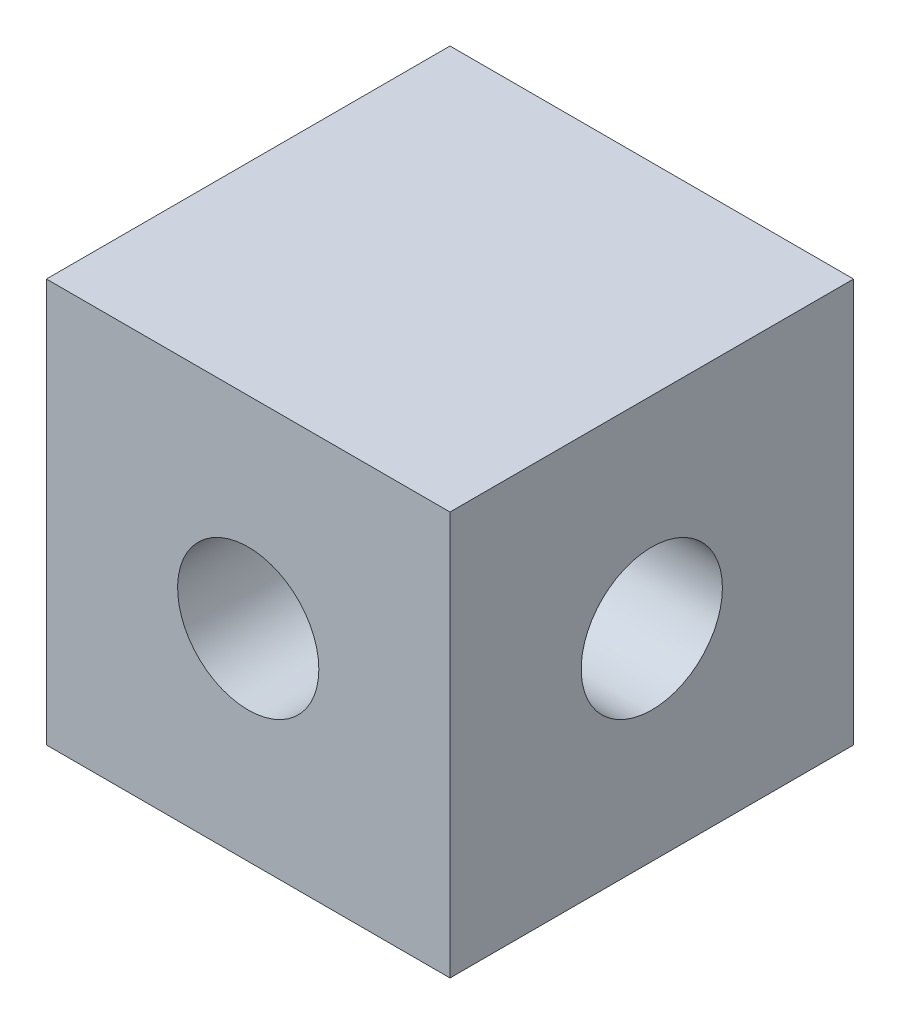
from build123d import *

# Parameters (mm, degrees)
SKETCH1_W           = 10
SKETCH1_H           = 10
SKETCH1_R           = 1.75
BOSS_EXTRUDE1_DEPTH = 10
SKETCH2_R           = 1.75
CUT_EXTRUDE1_DEPTH  = 8


with BuildPart() as part:
    # Sketch1 → Boss-Extrude1 (new body)
    with BuildSketch(Plane.XY):
        Rectangle(SKETCH1_W, SKETCH1_H)
        Circle(SKETCH1_R, mode=Mode.SUBTRACT)
    extrude(amount=BOSS_EXTRUDE1_DEPTH)

    # Sketch2 → Cut-Extrude1 (cut)
    with BuildSketch(Plane(origin=(5, 0, 0), x_dir=(0, 0, -1), z_dir=(1, 0, 0))):
        with Locations((-5, 0)):
            Circle(SKETCH2_R)
    extrude(amount=-CUT_EXTRUDE1_DEPTH, mode=Mode.SUBTRACT)


solid = part.part
